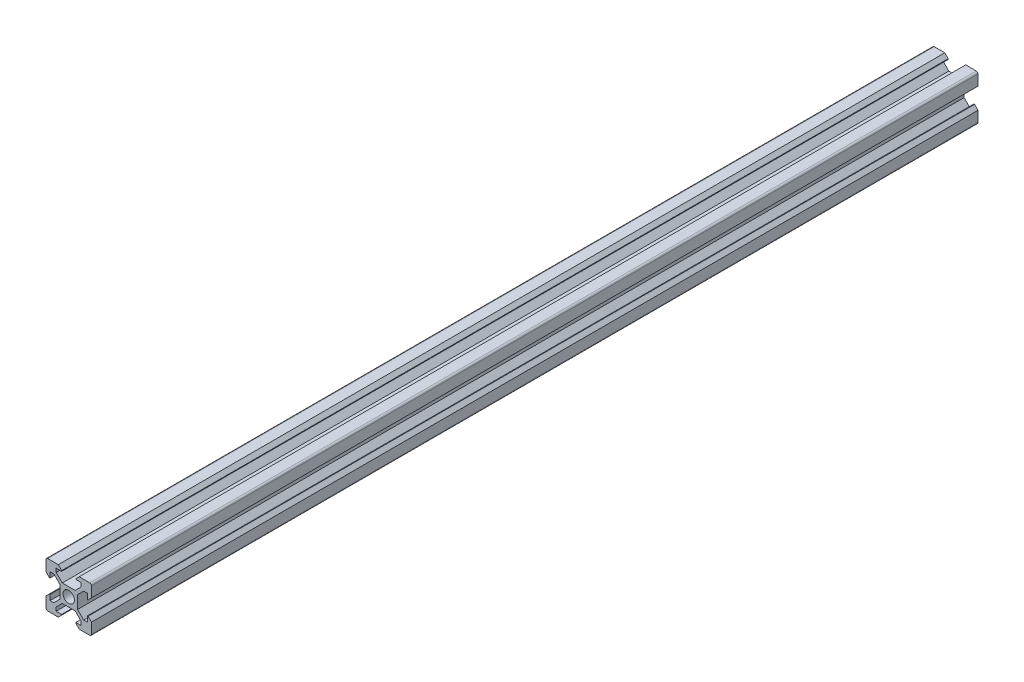
from build123d import *

# Parameters (mm, degrees)
CROQUIS1_R              = 2.5
SALIENTE_EXTRUIR1_DEPTH = 480
CUT_EXTRUDE1_DEPTH      = 65
CUT_EXTRUDE1_DEPTH_BACK = 31
SKETCH2_W               = 180
SKETCH2_H               = 42.677085212


with BuildPart() as part:
    # Croquis1 → Saliente-Extruir1 (new body)
    with BuildSketch(Plane.XY):
        with BuildLine():
            Line((-4.6, 10), (-3.1, 8.5))
            Line((-3.1, 8.5), (-3.1, 8.2))
            Line((-3.1, 8.2), (-5.5, 8.2))
            Line((-5.5, 8.2), (-5.5, 6.560660172))
            Line((-5.5, 6.560660172), (-2.84, 3.900660172))
            Line((-2.84, 3.900660172), (0, 3.900660172))
            Line((0, 3.900660172), (2.84, 3.900660172))
            Line((2.84, 3.900660172), (5.5, 6.560660172))
            Line((5.5, 6.560660172), (5.5, 8.2))
            Line((5.5, 8.2), (3.1, 8.2))
            Line((3.1, 8.2), (3.1, 8.5))
            Line((3.1, 8.5), (4.6, 10))
            Line((4.6, 10), (9.25, 10))
            ThreePointArc((9.25, 10), (9.780330086, 9.780330086), (10, 9.25))
            Line((10, 9.25), (10, 4.6))
            Line((10, 4.6), (8.5, 3.1))
            Line((8.5, 3.1), (8.2, 3.1))
            Line((8.2, 3.1), (8.2, 5.5))
            Line((8.2, 5.5), (6.560660172, 5.5))
            Line((6.560660172, 5.5), (3.900660172, 2.84))
            Line((3.900660172, 2.84), (3.900660172, 0))
            Line((3.900660172, 0), (3.900660172, -2.84))
            Line((3.900660172, -2.84), (6.560660172, -5.5))
            Line((6.560660172, -5.5), (8.2, -5.5))
            Line((8.2, -5.5), (8.2, -3.1))
            Line((8.2, -3.1), (8.5, -3.1))
            Line((8.5, -3.1), (10, -4.6))
            Line((10, -4.6), (10, -9.25))
            ThreePointArc((10, -9.25), (9.780330086, -9.780330086), (9.25, -10))
            Line((9.25, -10), (4.6, -10))
            Line((4.6, -10), (3.1, -8.5))
            Line((3.1, -8.5), (3.1, -8.2))
            Line((3.1, -8.2), (5.5, -8.2))
            Line((5.5, -8.2), (5.5, -6.560660172))
            Line((5.5, -6.560660172), (2.84, -3.900660172))
            Line((2.84, -3.900660172), (0, -3.900660172))
            Line((0, -3.900660172), (-2.84, -3.900660172))
            Line((-2.84, -3.900660172), (-5.5, -6.560660172))
            Line((-5.5, -6.560660172), (-5.5, -8.2))
            Line((-5.5, -8.2), (-3.1, -8.2))
            Line((-3.1, -8.2), (-3.1, -8.5))
            Line((-3.1, -8.5), (-4.6, -10))
            Line((-4.6, -10), (-9.25, -10))
            ThreePointArc((-9.25, -10), (-9.780330086, -9.780330086), (-10, -9.25))
            Line((-10, -9.25), (-10, -4.6))
            Line((-10, -4.6), (-8.5, -3.1))
            Line((-8.5, -3.1), (-8.2, -3.1))
            Line((-8.2, -3.1), (-8.2, -5.5))
            Line((-8.2, -5.5), (-6.560660172, -5.5))
            Line((-6.560660172, -5.5), (-3.900660172, -2.84))
            Line((-3.900660172, -2.84), (-3.900660172, 0))
            Line((-3.900660172, 0), (-3.900660172, 2.84))
            Line((-3.900660172, 2.84), (-6.560660172, 5.5))
            Line((-6.560660172, 5.5), (-8.2, 5.5))
            Line((-8.2, 5.5), (-8.2, 3.1))
            Line((-8.2, 3.1), (-8.5, 3.1))
            Line((-8.5, 3.1), (-10, 4.6))
            Line((-10, 4.6), (-10, 9.25))
            ThreePointArc((-10, 9.25), (-9.780330086, 9.780330086), (-9.25, 10))
            Line((-9.25, 10), (-4.6, 10))
        make_face()
        Circle(CROQUIS1_R, mode=Mode.SUBTRACT)
    extrude(amount=SALIENTE_EXTRUIR1_DEPTH)

    # Sketch2 → Cut-Extrude1 (cut, two sides: drawn at the far end of the back side and taken through both)
    with BuildSketch(Plane(origin=(0, 0, 0), x_dir=(0, 0, -1), z_dir=(1, 0, 0)).offset(-CUT_EXTRUDE1_DEPTH_BACK)):
        Rectangle(SKETCH2_W, SKETCH2_H)
    extrude(amount=CUT_EXTRUDE1_DEPTH + CUT_EXTRUDE1_DEPTH_BACK, mode=Mode.SUBTRACT)


solid = part.part
